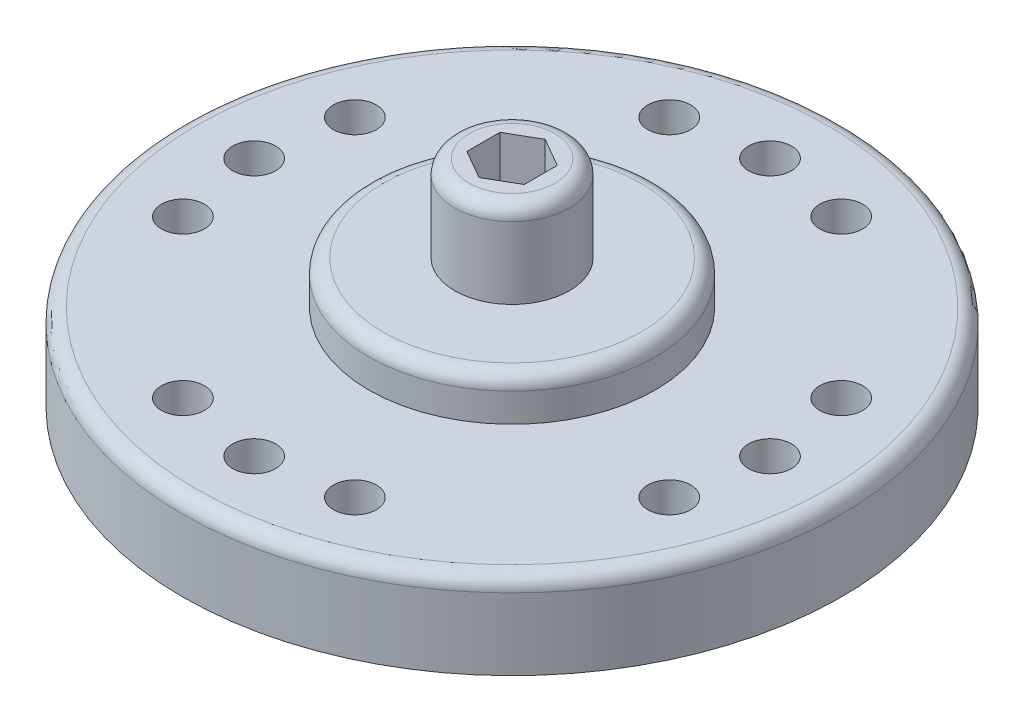
from build123d import *

# Parameters (mm, degrees)
CROQUIS1_R              = 11.5
SALIENTE_EXTRUIR1_DEPTH = 3
CROQUIS1_9_R            = 0.75
CORTAR_EXTRUIR2_DEPTH   = 3
MATRIZC2_COUNT          = 4
SALIENTE_EXTRUIR2_START = 3
CROQUIS1_11_R           = 5
SALIENTE_EXTRUIR2_DEPTH = 1.5
SALIENTE_EXTRUIR3_START = 4.5
CROQUIS1_12_R           = 2
SALIENTE_EXTRUIR3_DEPTH = 3
REDONDEO1_R             = 0.5
SALIENTE_EXTRUIR4_START = -1
CROQUIS1_13_R           = 5
CROQUIS1_13_R_2         = 2
SALIENTE_EXTRUIR4_DEPTH = 1


with BuildPart() as part:
    # Croquis1 → Saliente-Extruir1 (new body)
    with BuildSketch(Plane(origin=(0, 0, 0), x_dir=(1, 0, 0), z_dir=(0, 1, 0))):
        with Locations(Location((0, 13.3, 0), (0, 0, 270))):
            Circle(CROQUIS1_R)
    extrude(amount=SALIENTE_EXTRUIR1_DEPTH)

    # Croquis1<9> → Cortar-Extruir2 (cut)
    with BuildSketch(Plane(origin=(0, 0, 0), x_dir=(1, 0, 0), z_dir=(0, 1, 0))):
        with Locations(Location((0, 22.3, 0), (0, 0, 270))):
            Circle(CROQUIS1_9_R)
        with Locations(Location((3, 21.785281374, 0), (0, 0, 270))):
            Circle(CROQUIS1_9_R)
        with Locations(Location((-3, 21.785281374, 0), (0, 0, 90))):
            Circle(CROQUIS1_9_R)
    cortar_extruir2 = extrude(amount=CORTAR_EXTRUIR2_DEPTH, mode=Mode.SUBTRACT)

    # MatrizC2: Cortar-Extruir2 ×4 about axis
    matrizc2_axis = Axis((0, 0, -13.3), (0, 1, 0))
    for i in range(1, MATRIZC2_COUNT):
        add(cortar_extruir2.rotate(matrizc2_axis, i * 360 / MATRIZC2_COUNT), mode=Mode.SUBTRACT)

    # Croquis1<11> → Saliente-Extruir2 (add)
    with BuildSketch(Plane(origin=(0, 0, 0), x_dir=(1, 0, 0), z_dir=(0, 1, 0)).offset(SALIENTE_EXTRUIR2_START)):
        with Locations(Location((0, 13.3, 0), (0, 0, 270))):
            Circle(CROQUIS1_11_R)
    extrude(amount=SALIENTE_EXTRUIR2_DEPTH)

    # Croquis1<12> → Saliente-Extruir3 (add)
    with BuildSketch(Plane(origin=(0, 0, 0), x_dir=(1, 0, 0), z_dir=(0, 1, 0)).offset(SALIENTE_EXTRUIR3_START)):
        with Locations(Location((0, 13.3, 0), (0, 0, 270))):
            Circle(CROQUIS1_12_R)
        Polygon((1, 12.722649731), (1, 13.877350269), (0, 14.454700538), (-1, 13.877350269), (-1, 12.722649731), (0, 12.145299462), align=None, mode=Mode.SUBTRACT)
    extrude(amount=SALIENTE_EXTRUIR3_DEPTH)

    # Redondeo1
    redondeo1_edges = [part.edges().sort_by_distance(p)[0] for p in [
        (0, 3, -24.8),
        (0, 4.5, -18.3),
        (0, 7.5, -15.3),
    ]]
    fillet(redondeo1_edges, radius=REDONDEO1_R)

    # Croquis1<13> → Saliente-Extruir4 (add)
    with BuildSketch(Plane(origin=(0, 0, 0), x_dir=(1, 0, 0), z_dir=(0, 1, 0)).offset(SALIENTE_EXTRUIR4_START)):
        with Locations(Location((0, 13.3, 0), (0, 0, 270))):
            Circle(CROQUIS1_13_R)
        with Locations(Location((0, 13.3, 0), (0, 0, 270))):
            Circle(CROQUIS1_13_R_2, mode=Mode.SUBTRACT)
    extrude(amount=SALIENTE_EXTRUIR4_DEPTH)


solid = part.part
